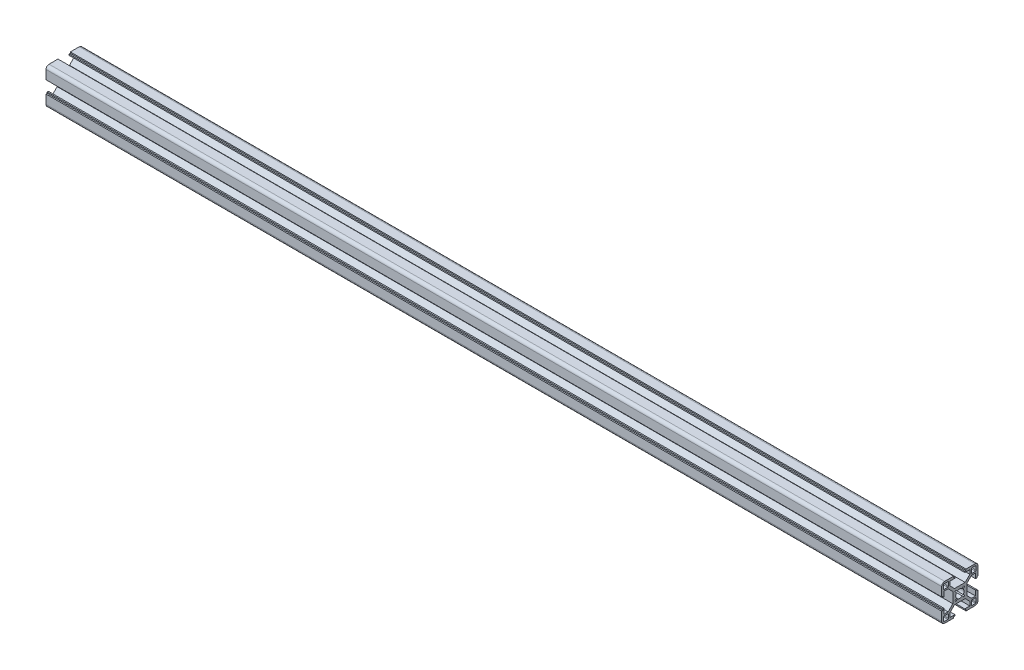
from build123d import *

# Parameters (mm, degrees)
EXTRUDE_1_DEPTH     = 50
EXTRUDE_2_DEPTH     = 740
CUT_EXTRUDE_START   = 15.049571
SKETCH_4_R          = 3
CUT_EXTRUDE_1_DEPTH = 30
CUT_EXTRUDE_START_2 = 15.29533
SKETCH_5_R          = 3
CUT_EXTRUDE_2_DEPTH = 30


with BuildPart() as part:
    # 草图1 → 凸台-拉伸1 (new body)
    with BuildSketch(Plane(origin=(0, 0, 0), x_dir=(0, 0, -1), z_dir=(1, 0, 0))):
        with BuildLine():
            Line((-5.14957074, -13.70467014), (-4.14957074, -13.70467014))
            Line((-4.14957074, -13.70467014), (-4.14957074, -12.70467014))
            Line((-4.14957074, -12.70467014), (-8.29957074, -12.70467014))
            Line((-8.29957074, -12.70467014), (-8.29957074, -9.3688837))
            Line((-8.29957074, -9.3688837), (-4.43535718, -5.50467014))
            Line((-4.43535718, -5.50467014), (4.3362157, -5.50467014))
            Line((4.3362157, -5.50467014), (8.20042926, -9.3688837))
            Line((8.20042926, -9.3688837), (8.20042926, -12.70467014))
            Line((8.20042926, -12.70467014), (4.05042926, -12.70467014))
            Line((4.05042926, -12.70467014), (4.05042926, -13.70467014))
            Line((4.05042926, -13.70467014), (5.05042926, -13.70467014))
            Line((5.05042926, -13.70467014), (5.05042926, -14.70467014))
            Line((5.05042926, -14.70467014), (12.45042926, -14.70467014))
            ThreePointArc((12.45042926, -14.70467014), (14.218196213, -13.972437093), (14.95042926, -12.20467014))
            Line((14.95042926, -12.20467014), (14.95042926, -4.80467014))
            Line((14.95042926, -4.80467014), (13.95042926, -4.80467014))
            Line((13.95042926, -4.80467014), (13.95042926, -3.80467014))
            Line((13.95042926, -3.80467014), (12.95042926, -3.80467014))
            Line((12.95042926, -3.80467014), (12.95042926, -7.95467014))
            Line((12.95042926, -7.95467014), (9.61464282, -7.95467014))
            Line((9.61464282, -7.95467014), (5.75042926, -4.09045658))
            Line((5.75042926, -4.09045658), (5.75042926, 4.6811163))
            Line((5.75042926, 4.6811163), (9.61464282, 8.54532986))
            Line((9.61464282, 8.54532986), (12.95042926, 8.54532986))
            Line((12.95042926, 8.54532986), (12.95042926, 4.39532986))
            Line((12.95042926, 4.39532986), (13.95042926, 4.39532986))
            Line((13.95042926, 4.39532986), (13.95042926, 5.39532986))
            Line((13.95042926, 5.39532986), (14.95042926, 5.39532986))
            Line((14.95042926, 5.39532986), (14.95042926, 12.79532986))
            ThreePointArc((14.95042926, 12.79532986), (14.218196213, 14.563096813), (12.45042926, 15.29532986))
            Line((12.45042926, 15.29532986), (5.05042926, 15.29532986))
            Line((5.05042926, 15.29532986), (5.05042926, 14.29532986))
            Line((5.05042926, 14.29532986), (4.05042926, 14.29532986))
            Line((4.05042926, 14.29532986), (4.05042926, 13.29532986))
            Line((4.05042926, 13.29532986), (8.20042926, 13.29532986))
            Line((8.20042926, 13.29532986), (8.20042926, 9.95954342))
            Line((8.20042926, 9.95954342), (4.3362157, 6.09532986))
            Line((4.3362157, 6.09532986), (-4.43535718, 6.09532986))
            Line((-4.43535718, 6.09532986), (-8.29957074, 9.95954342))
            Line((-8.29957074, 9.95954342), (-8.29957074, 13.29532986))
            Line((-8.29957074, 13.29532986), (-4.14957074, 13.29532986))
            Line((-4.14957074, 13.29532986), (-4.14957074, 14.29532986))
            Line((-4.14957074, 14.29532986), (-5.14957074, 14.29532986))
            Line((-5.14957074, 14.29532986), (-5.14957074, 15.29532986))
            Line((-5.14957074, 15.29532986), (-12.54957074, 15.29532986))
            ThreePointArc((-12.54957074, 15.29532986), (-14.317337693, 14.563096813), (-15.04957074, 12.79532986))
            Line((-15.04957074, 12.79532986), (-15.04957074, 5.39532986))
            Line((-15.04957074, 5.39532986), (-14.04957074, 5.39532986))
            Line((-14.04957074, 5.39532986), (-14.04957074, 4.39532986))
            Line((-14.04957074, 4.39532986), (-13.04957074, 4.39532986))
            Line((-13.04957074, 4.39532986), (-13.04957074, 8.54532986))
            Line((-13.04957074, 8.54532986), (-9.7137843, 8.54532986))
            Line((-9.7137843, 8.54532986), (-5.84957074, 4.6811163))
            Line((-5.84957074, 4.6811163), (-5.84957074, -4.09045658))
            Line((-5.84957074, -4.09045658), (-9.7137843, -7.95467014))
            Line((-9.7137843, -7.95467014), (-13.04957074, -7.95467014))
            Line((-13.04957074, -7.95467014), (-13.04957074, -3.80467014))
            Line((-13.04957074, -3.80467014), (-14.04957074, -3.80467014))
            Line((-14.04957074, -3.80467014), (-14.04957074, -4.80467014))
            Line((-14.04957074, -4.80467014), (-15.04957074, -4.80467014))
            Line((-15.04957074, -4.80467014), (-15.04957074, -12.20467014))
            ThreePointArc((-15.04957074, -12.20467014), (-14.317337693, -13.972437093), (-12.54957074, -14.70467014))
            Line((-12.54957074, -14.70467014), (-5.14957074, -14.70467014))
            Line((-5.14957074, -14.70467014), (-5.14957074, -13.70467014))
        make_face()
        with BuildLine():
            Line((-10.04957074, 9.79532986), (-13.04957074, 9.79532986))
            ThreePointArc((-13.04957074, 9.79532986), (-13.403124131, 9.941776469), (-13.54957074, 10.29532986))
            Line((-13.54957074, 10.29532986), (-13.54957074, 13.29532986))
            ThreePointArc((-13.54957074, 13.29532986), (-13.403124131, 13.648883251), (-13.04957074, 13.79532986))
            Line((-13.04957074, 13.79532986), (-10.04957074, 13.79532986))
            ThreePointArc((-10.04957074, 13.79532986), (-9.696017349, 13.648883251), (-9.54957074, 13.29532986))
            Line((-9.54957074, 13.29532986), (-9.54957074, 10.29532986))
            ThreePointArc((-9.54957074, 10.29532986), (-9.696017349, 9.941776469), (-10.04957074, 9.79532986))
        make_face(mode=Mode.SUBTRACT)
        with BuildLine():
            Line((-10.04957074, -13.20467014), (-13.04957074, -13.20467014))
            ThreePointArc((-13.04957074, -13.20467014), (-13.403124131, -13.058223531), (-13.54957074, -12.70467014))
            Line((-13.54957074, -12.70467014), (-13.54957074, -9.70467014))
            ThreePointArc((-13.54957074, -9.70467014), (-13.403124131, -9.351116749), (-13.04957074, -9.20467014))
            Line((-13.04957074, -9.20467014), (-10.04957074, -9.20467014))
            ThreePointArc((-10.04957074, -9.20467014), (-9.696017349, -9.351116749), (-9.54957074, -9.70467014))
            Line((-9.54957074, -9.70467014), (-9.54957074, -12.70467014))
            ThreePointArc((-9.54957074, -12.70467014), (-9.696017349, -13.058223531), (-10.04957074, -13.20467014))
        make_face(mode=Mode.SUBTRACT)
        with BuildLine():
            Line((12.95042926, 9.79532986), (9.95042926, 9.79532986))
            ThreePointArc((9.95042926, 9.79532986), (9.596875869, 9.941776469), (9.45042926, 10.29532986))
            Line((9.45042926, 10.29532986), (9.45042926, 13.29532986))
            ThreePointArc((9.45042926, 13.29532986), (9.596875869, 13.648883251), (9.95042926, 13.79532986))
            Line((9.95042926, 13.79532986), (12.95042926, 13.79532986))
            ThreePointArc((12.95042926, 13.79532986), (13.303982651, 13.648883251), (13.45042926, 13.29532986))
            Line((13.45042926, 13.29532986), (13.45042926, 10.29532986))
            ThreePointArc((13.45042926, 10.29532986), (13.303982651, 9.941776469), (12.95042926, 9.79532986))
        make_face(mode=Mode.SUBTRACT)
        with BuildLine():
            Line((13.45042926, -9.70467014), (13.45042926, -12.70467014))
            ThreePointArc((13.45042926, -12.70467014), (13.303982651, -13.058223531), (12.95042926, -13.20467014))
            Line((12.95042926, -13.20467014), (9.95042926, -13.20467014))
            ThreePointArc((9.95042926, -13.20467014), (9.596875869, -13.058223531), (9.45042926, -12.70467014))
            Line((9.45042926, -12.70467014), (9.45042926, -9.70467014))
            ThreePointArc((9.45042926, -9.70467014), (9.596875869, -9.351116749), (9.95042926, -9.20467014))
            Line((9.95042926, -9.20467014), (12.95042926, -9.20467014))
            ThreePointArc((12.95042926, -9.20467014), (13.303982651, -9.351116749), (13.45042926, -9.70467014))
        make_face(mode=Mode.SUBTRACT)
        with BuildLine():
            Line((-4.07998961, 3.61864195), (-3.37288283, 4.32574873))
            Line((-3.37288283, 4.32574873), (-2.07404174, 3.02690764))
            ThreePointArc((-2.07404174, 3.02690764), (-0.04957074, 3.69532986), (1.97490026, 3.02690764))
            Line((1.97490026, 3.02690764), (3.27374135, 4.32574873))
            Line((3.27374135, 4.32574873), (3.98084813, 3.61864195))
            Line((3.98084813, 3.61864195), (2.68200704, 2.31980086))
            ThreePointArc((2.68200704, 2.31980086), (3.35042926, 0.29532986), (2.68200704, -1.72914114))
            Line((2.68200704, -1.72914114), (3.98084813, -3.02798223))
            Line((3.98084813, -3.02798223), (3.27374135, -3.73508901))
            Line((3.27374135, -3.73508901), (1.97490026, -2.43624792))
            ThreePointArc((1.97490026, -2.43624792), (-0.04957074, -3.10467014), (-2.07404174, -2.43624792))
            Line((-2.07404174, -2.43624792), (-3.37288283, -3.73508901))
            Line((-3.37288283, -3.73508901), (-4.07998961, -3.02798223))
            Line((-4.07998961, -3.02798223), (-2.78114852, -1.72914114))
            ThreePointArc((-2.78114852, -1.72914114), (-3.44957074, 0.29532986), (-2.78114852, 2.31980086))
            Line((-2.78114852, 2.31980086), (-4.07998961, 3.61864195))
        make_face(mode=Mode.SUBTRACT)
    extrude(amount=-EXTRUDE_1_DEPTH)

    # 草图2 → 凸台-拉伸2 (add)
    with BuildSketch(Plane(origin=(0, 0, 0), x_dir=(0, 0, -1), z_dir=(1, 0, 0))):
        with BuildLine():
            Line((-15.04957074, -4.80467014), (-15.04957074, -12.20467014))
            ThreePointArc((-15.04957074, -12.20467014), (-14.317337693, -13.972437093), (-12.54957074, -14.70467014))
            Line((-12.54957074, -14.70467014), (-5.14957074, -14.70467014))
            Line((-5.14957074, -14.70467014), (-5.14957074, -13.70467014))
            Line((-5.14957074, -13.70467014), (-4.14957074, -13.70467014))
            Line((-4.14957074, -13.70467014), (-4.14957074, -12.70467014))
            Line((-4.14957074, -12.70467014), (-8.29957074, -12.70467014))
            Line((-8.29957074, -12.70467014), (-8.29957074, -9.3688837))
            Line((-8.29957074, -9.3688837), (-4.43535718, -5.50467014))
            Line((-4.43535718, -5.50467014), (4.3362157, -5.50467014))
            Line((4.3362157, -5.50467014), (8.20042926, -9.3688837))
            Line((8.20042926, -9.3688837), (8.20042926, -12.70467014))
            Line((8.20042926, -12.70467014), (4.05042926, -12.70467014))
            Line((4.05042926, -12.70467014), (4.05042926, -13.70467014))
            Line((4.05042926, -13.70467014), (5.05042926, -13.70467014))
            Line((5.05042926, -13.70467014), (5.05042926, -14.70467014))
            Line((5.05042926, -14.70467014), (12.45042926, -14.70467014))
            ThreePointArc((12.45042926, -14.70467014), (14.218196213, -13.972437093), (14.95042926, -12.20467014))
            Line((14.95042926, -12.20467014), (14.95042926, -4.80467014))
            Line((14.95042926, -4.80467014), (13.95042926, -4.80467014))
            Line((13.95042926, -4.80467014), (13.95042926, -3.80467014))
            Line((13.95042926, -3.80467014), (12.95042926, -3.80467014))
            Line((12.95042926, -3.80467014), (12.95042926, -7.95467014))
            Line((12.95042926, -7.95467014), (9.61464282, -7.95467014))
            Line((9.61464282, -7.95467014), (5.75042926, -4.09045658))
            Line((5.75042926, -4.09045658), (5.75042926, 4.6811163))
            Line((5.75042926, 4.6811163), (9.61464282, 8.54532986))
            Line((9.61464282, 8.54532986), (12.95042926, 8.54532986))
            Line((12.95042926, 8.54532986), (12.95042926, 4.39532986))
            Line((12.95042926, 4.39532986), (13.95042926, 4.39532986))
            Line((13.95042926, 4.39532986), (13.95042926, 5.39532986))
            Line((13.95042926, 5.39532986), (14.95042926, 5.39532986))
            Line((14.95042926, 5.39532986), (14.95042926, 12.79532986))
            ThreePointArc((14.95042926, 12.79532986), (14.218196213, 14.563096813), (12.45042926, 15.29532986))
            Line((12.45042926, 15.29532986), (5.05042926, 15.29532986))
            Line((5.05042926, 15.29532986), (5.05042926, 14.29532986))
            Line((5.05042926, 14.29532986), (4.05042926, 14.29532986))
            Line((4.05042926, 14.29532986), (4.05042926, 13.29532986))
            Line((4.05042926, 13.29532986), (8.20042926, 13.29532986))
            Line((8.20042926, 13.29532986), (8.20042926, 9.95954342))
            Line((8.20042926, 9.95954342), (4.3362157, 6.09532986))
            Line((4.3362157, 6.09532986), (-4.43535718, 6.09532986))
            Line((-4.43535718, 6.09532986), (-8.29957074, 9.95954342))
            Line((-8.29957074, 9.95954342), (-8.29957074, 13.29532986))
            Line((-8.29957074, 13.29532986), (-4.14957074, 13.29532986))
            Line((-4.14957074, 13.29532986), (-4.14957074, 14.29532986))
            Line((-4.14957074, 14.29532986), (-5.14957074, 14.29532986))
            Line((-5.14957074, 14.29532986), (-5.14957074, 15.29532986))
            Line((-5.14957074, 15.29532986), (-12.54957074, 15.29532986))
            ThreePointArc((-12.54957074, 15.29532986), (-14.317337693, 14.563096813), (-15.04957074, 12.79532986))
            Line((-15.04957074, 12.79532986), (-15.04957074, 5.39532986))
            Line((-15.04957074, 5.39532986), (-14.04957074, 5.39532986))
            Line((-14.04957074, 5.39532986), (-14.04957074, 4.39532986))
            Line((-14.04957074, 4.39532986), (-13.04957074, 4.39532986))
            Line((-13.04957074, 4.39532986), (-13.04957074, 8.54532986))
            Line((-13.04957074, 8.54532986), (-9.7137843, 8.54532986))
            Line((-9.7137843, 8.54532986), (-5.84957074, 4.6811163))
            Line((-5.84957074, 4.6811163), (-5.84957074, -4.09045658))
            Line((-5.84957074, -4.09045658), (-9.7137843, -7.95467014))
            Line((-9.7137843, -7.95467014), (-13.04957074, -7.95467014))
            Line((-13.04957074, -7.95467014), (-13.04957074, -3.80467014))
            Line((-13.04957074, -3.80467014), (-14.04957074, -3.80467014))
            Line((-14.04957074, -3.80467014), (-14.04957074, -4.80467014))
            Line((-14.04957074, -4.80467014), (-15.04957074, -4.80467014))
        make_face()
        with BuildLine():
            Line((-13.04957074, 9.79532986), (-10.04957074, 9.79532986))
            ThreePointArc((-10.04957074, 9.79532986), (-9.696017349, 9.941776469), (-9.54957074, 10.29532986))
            Line((-9.54957074, 10.29532986), (-9.54957074, 13.29532986))
            ThreePointArc((-9.54957074, 13.29532986), (-9.696017349, 13.648883251), (-10.04957074, 13.79532986))
            Line((-10.04957074, 13.79532986), (-13.04957074, 13.79532986))
            ThreePointArc((-13.04957074, 13.79532986), (-13.403124131, 13.648883251), (-13.54957074, 13.29532986))
            Line((-13.54957074, 13.29532986), (-13.54957074, 10.29532986))
            ThreePointArc((-13.54957074, 10.29532986), (-13.403124131, 9.941776469), (-13.04957074, 9.79532986))
        make_face(mode=Mode.SUBTRACT)
        with BuildLine():
            Line((-13.04957074, -13.20467014), (-10.04957074, -13.20467014))
            ThreePointArc((-10.04957074, -13.20467014), (-9.696017349, -13.058223531), (-9.54957074, -12.70467014))
            Line((-9.54957074, -12.70467014), (-9.54957074, -9.70467014))
            ThreePointArc((-9.54957074, -9.70467014), (-9.696017349, -9.351116749), (-10.04957074, -9.20467014))
            Line((-10.04957074, -9.20467014), (-13.04957074, -9.20467014))
            ThreePointArc((-13.04957074, -9.20467014), (-13.403124131, -9.351116749), (-13.54957074, -9.70467014))
            Line((-13.54957074, -9.70467014), (-13.54957074, -12.70467014))
            ThreePointArc((-13.54957074, -12.70467014), (-13.403124131, -13.058223531), (-13.04957074, -13.20467014))
        make_face(mode=Mode.SUBTRACT)
        with BuildLine():
            Line((9.45042926, 13.29532986), (9.45042926, 10.29532986))
            ThreePointArc((9.45042926, 10.29532986), (9.596875869, 9.941776469), (9.95042926, 9.79532986))
            Line((9.95042926, 9.79532986), (12.95042926, 9.79532986))
            ThreePointArc((12.95042926, 9.79532986), (13.303982651, 9.941776469), (13.45042926, 10.29532986))
            Line((13.45042926, 10.29532986), (13.45042926, 13.29532986))
            ThreePointArc((13.45042926, 13.29532986), (13.303982651, 13.648883251), (12.95042926, 13.79532986))
            Line((12.95042926, 13.79532986), (9.95042926, 13.79532986))
            ThreePointArc((9.95042926, 13.79532986), (9.596875869, 13.648883251), (9.45042926, 13.29532986))
        make_face(mode=Mode.SUBTRACT)
        with BuildLine():
            Line((9.45042926, -9.70467014), (9.45042926, -12.70467014))
            ThreePointArc((9.45042926, -12.70467014), (9.596875869, -13.058223531), (9.95042926, -13.20467014))
            Line((9.95042926, -13.20467014), (12.95042926, -13.20467014))
            ThreePointArc((12.95042926, -13.20467014), (13.303982651, -13.058223531), (13.45042926, -12.70467014))
            Line((13.45042926, -12.70467014), (13.45042926, -9.70467014))
            ThreePointArc((13.45042926, -9.70467014), (13.303982651, -9.351116749), (12.95042926, -9.20467014))
            Line((12.95042926, -9.20467014), (9.95042926, -9.20467014))
            ThreePointArc((9.95042926, -9.20467014), (9.596875869, -9.351116749), (9.45042926, -9.70467014))
        make_face(mode=Mode.SUBTRACT)
        with BuildLine():
            Line((-3.37288283, -3.73508901), (-2.07404174, -2.43624792))
            ThreePointArc((-2.07404174, -2.43624792), (-0.04957074, -3.10467014), (1.97490026, -2.43624792))
            Line((1.97490026, -2.43624792), (3.27374135, -3.73508901))
            Line((3.27374135, -3.73508901), (3.98084813, -3.02798223))
            Line((3.98084813, -3.02798223), (2.68200704, -1.72914114))
            ThreePointArc((2.68200704, -1.72914114), (3.35042926, 0.29532986), (2.68200704, 2.31980086))
            Line((2.68200704, 2.31980086), (3.98084813, 3.61864195))
            Line((3.98084813, 3.61864195), (3.27374135, 4.32574873))
            Line((3.27374135, 4.32574873), (1.97490026, 3.02690764))
            ThreePointArc((1.97490026, 3.02690764), (-0.04957074, 3.69532986), (-2.07404174, 3.02690764))
            Line((-2.07404174, 3.02690764), (-3.37288283, 4.32574873))
            Line((-3.37288283, 4.32574873), (-4.07998961, 3.61864195))
            Line((-4.07998961, 3.61864195), (-2.78114852, 2.31980086))
            ThreePointArc((-2.78114852, 2.31980086), (-3.44957074, 0.29532986), (-2.78114852, -1.72914114))
            Line((-2.78114852, -1.72914114), (-4.07998961, -3.02798223))
            Line((-4.07998961, -3.02798223), (-3.37288283, -3.73508901))
        make_face(mode=Mode.SUBTRACT)
    extrude(amount=-EXTRUDE_2_DEPTH)

    # 草图4 → 切除-拉伸1 (cut)
    with BuildSketch(Plane.XY.offset(CUT_EXTRUDE_START)):
        with Locations(Location((-726.5, 0, 0), (0, 0, 324.803641529))):
            Circle(SKETCH_4_R)
        with Locations(Location((-13.5, 0, 0), (0, 0, 324.803641529))):
            Circle(SKETCH_4_R)
    extrude(amount=-CUT_EXTRUDE_1_DEPTH, mode=Mode.SUBTRACT)

    # 草图5 → 切除-拉伸2 (cut)
    with BuildSketch(Plane(origin=(0, 0, 0), x_dir=(1, 0, 0), z_dir=(0, 1, 0)).offset(CUT_EXTRUDE_START_2)):
        with Locations(Location((-407.5, 0, 0), (0, 0, 316.263150046))):
            Circle(SKETCH_5_R)
        with Locations(Location((-332.5, 0, 0), (0, 0, 316.263150046))):
            Circle(SKETCH_5_R)
    extrude(amount=-CUT_EXTRUDE_2_DEPTH, mode=Mode.SUBTRACT)


solid = part.part
